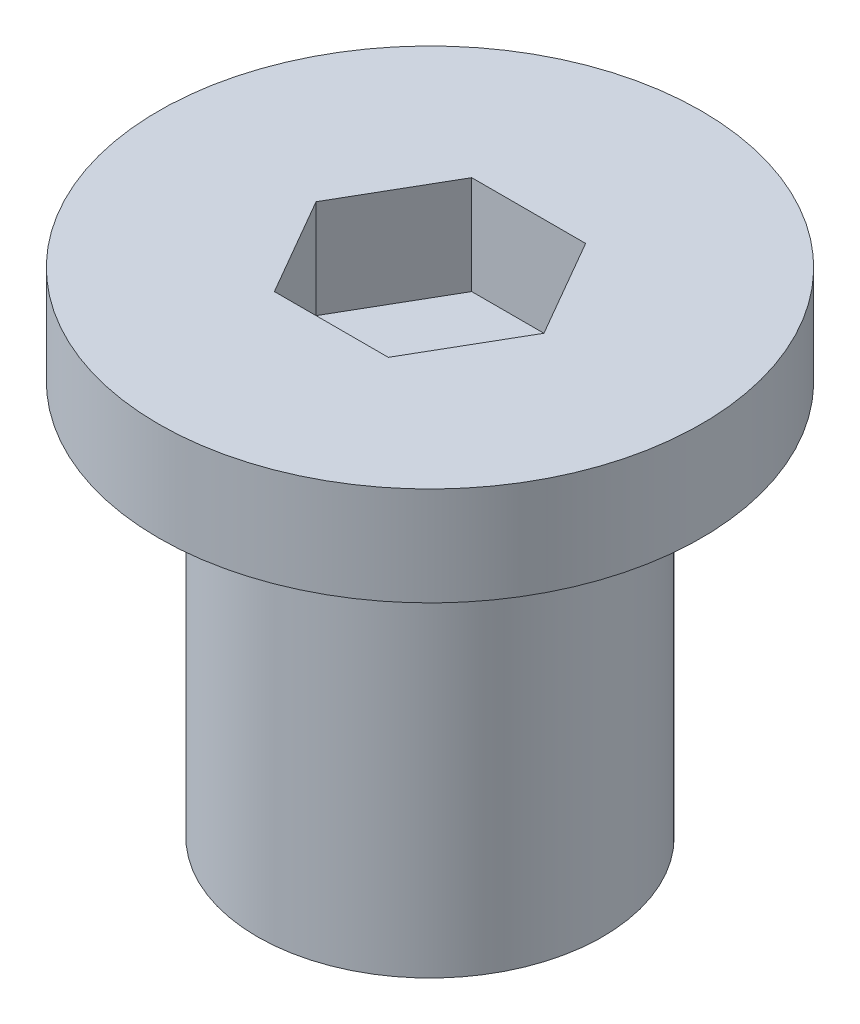
from build123d import *

# Parameters (mm, degrees)
SKETCH1_R           = 1.75
BOSS_EXTRUDE1_DEPTH = 2
SKETCH2_R           = 2.75
BOSS_EXTRUDE2_DEPTH = 1
CUT_EXTRUDE1_DEPTH  = 1


with BuildPart() as part:
    # Sketch1 → Boss-Extrude1 (new, symmetric)
    with BuildSketch(Plane(origin=(0, 0, 0), x_dir=(1, 0, 0), z_dir=(0, 1, 0))):
        with Locations(Location((0, 0, 0), (0, 0, 270))):
            Circle(SKETCH1_R)
    extrude(amount=BOSS_EXTRUDE1_DEPTH, both=True)

    # Sketch2 → Boss-Extrude2 (add)
    with BuildSketch(Plane(origin=(0, 2, 0), x_dir=(1, 0, 0), z_dir=(0, 1, 0))):
        with Locations(Location((0, 0, 0), (0, 0, 270))):
            Circle(SKETCH2_R)
    extrude(amount=BOSS_EXTRUDE2_DEPTH)

    # Sketch3 → Cut-Extrude1 (cut)
    with BuildSketch(Plane(origin=(0, 3, 0), x_dir=(1, 0, 0), z_dir=(0, 1, 0))):
        Polygon((1.154700538, 0), (0.577350269, 1), (-0.577350269, 1), (-1.154700538, 0), (-0.577350269, -1), (0.577350269, -1), align=None)
    extrude(amount=-CUT_EXTRUDE1_DEPTH, mode=Mode.SUBTRACT)


solid = part.part
